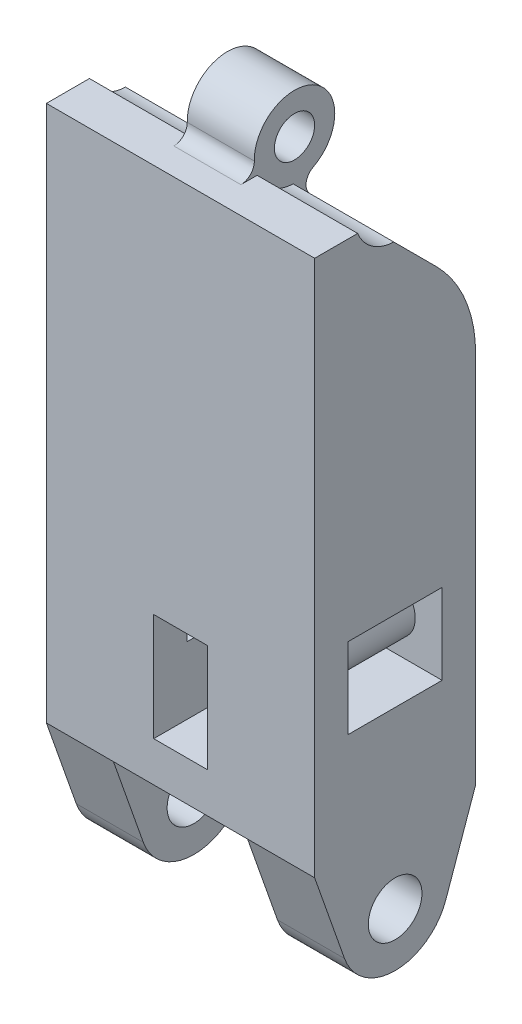
from build123d import *

# Parameters (mm, degrees)
SKETCH1_W               = 20
SKETCH1_H               = 40
BOSS_EXTRUDE1_DEPTH     = 12
CUT_EXTRUDE1_DEPTH      = 43.941821107
CUT_EXTRUDE1_DEPTH_BACK = 43.941821107
CUT_EXTRUDE2_DEPTH      = 43.941821107
CUT_EXTRUDE2_DEPTH_BACK = 43.941821107
SKETCH4_R               = 3
SKETCH4_R_2             = 1.5
BOSS_EXTRUDE2_DEPTH     = 2.5
FILLET1_R               = 1
SKETCH5_R               = 2
BOSS_EXTRUDE3_DEPTH     = 5
BOSS_EXTRUDE4_START     = -5
SKETCH7_R               = 2
BOSS_EXTRUDE4_DEPTH     = 5
FILLET2_R               = 10
SKETCH8_W               = 7
SKETCH8_H               = 6
CUT_EXTRUDE3_DEPTH      = 8
SKETCH10_R              = 2
BOSS_EXTRUDE5_DEPTH     = 7
SKETCH11_W              = 7
SKETCH11_H              = 6
CUT_EXTRUDE4_DEPTH      = 8
SKETCH12_R              = 2
BOSS_EXTRUDE6_DEPTH     = 8
SKETCH13_W              = 4
SKETCH13_H              = 8
CUT_EXTRUDE5_DEPTH      = 6
SKETCH16_W              = 4
SKETCH16_H              = 3
CUT_EXTRUDE6_DEPTH      = 6
SKETCH17_W              = 4
SKETCH17_H              = 8.017766953
CUT_EXTRUDE7_DEPTH      = 52.429563482


with BuildPart() as part:
    # Sketch1 → Boss-Extrude1 (new body)
    with BuildSketch(Plane.XY):
        with Locations((0, -20)):
            Rectangle(SKETCH1_W, SKETCH1_H)
    extrude(amount=BOSS_EXTRUDE1_DEPTH)

    # Sketch2 → Cut-Extrude1 (cut, two sides: drawn at the far end of the back side and taken through both)
    with BuildSketch(Plane(origin=(0, 0, 0), x_dir=(0, 0, -1), z_dir=(1, 0, 0)).offset(-CUT_EXTRUDE1_DEPTH_BACK)):
        Polygon((-8, 0), (0, 0), (0, -8), align=None)
    extrude(amount=CUT_EXTRUDE1_DEPTH + CUT_EXTRUDE1_DEPTH_BACK, mode=Mode.SUBTRACT)

    # Sketch3 → Cut-Extrude2 (cut, two sides: drawn at the far end of the back side and taken through both)
    with BuildSketch(Plane(origin=(0, 0, 0), x_dir=(0, 0, -1), z_dir=(1, 0, 0)).offset(-CUT_EXTRUDE2_DEPTH_BACK)):
        with BuildLine():
            ThreePointArc((-3, 1.1), (-6.559834153, 4.04730143), (-8.791057147, 0))
            Line((-8.791057147, 0), (-7.019803903, 0))
            ThreePointArc((-7.019803903, 0), (-6.600122548, 2.474719218), (-4.5, 1.1))
            ThreePointArc((-4.5, 1.1), (-4.625280782, 0.499877452), (-4.980196097, 0))
            Line((-4.980196097, 0), (-3.208942853, 0))
            ThreePointArc((-3.208942853, 0), (-3.05269857, 0.540165847), (-3, 1.1))
        make_face()
        with BuildLine():
            Line((-7.019803903, 0), (-8.791057147, 0))
            ThreePointArc((-8.791057147, 0), (-6, -1.9), (-3.208942853, 0))
            Line((-3.208942853, 0), (-4.980196097, 0))
            ThreePointArc((-4.980196097, 0), (-6, -0.4), (-7.019803903, 0))
        make_face()
    extrude(amount=CUT_EXTRUDE2_DEPTH + CUT_EXTRUDE2_DEPTH_BACK, mode=Mode.SUBTRACT)

    # Sketch4 → Boss-Extrude2 (add, symmetric)
    with BuildSketch(Plane(origin=(0, 0, 0), x_dir=(0, 0, -1), z_dir=(1, 0, 0))):
        with Locations((-6, 1.1)):
            Circle(SKETCH4_R)
        with Locations((-6, 1.1)):
            Circle(SKETCH4_R_2, mode=Mode.SUBTRACT)
    extrude(amount=BOSS_EXTRUDE2_DEPTH, both=True)

    # Fillet1
    fillet1_edges = [part.edges().sort_by_distance(p)[0] for p in [
        (0, -1.898274836, 6.101725164),
        (0, 0, 8.791057147),
    ]]
    fillet(fillet1_edges, radius=FILLET1_R)

    # Sketch5 → Boss-Extrude3 (add)
    with BuildSketch(Plane(origin=(10, 0, 0), x_dir=(0, 0, -1), z_dir=(1, 0, 0))):
        with BuildLine():
            Line((-2.226818383, -46.327817941), (0, -40))
            Line((0, -40), (-12, -40))
            Line((-12, -40), (-9.773181617, -46.327817941))
            ThreePointArc((-9.773181617, -46.327817941), (-6, -49), (-2.226818383, -46.327817941))
        make_face()
        with Locations(Location((-6, -45, 0), (0, 0, 90))):
            Circle(SKETCH5_R, mode=Mode.SUBTRACT)
    extrude(amount=-BOSS_EXTRUDE3_DEPTH)

    # Sketch7 → Boss-Extrude4 (add)
    with BuildSketch(Plane.ZY.offset(10).offset(BOSS_EXTRUDE4_START)):
        with BuildLine():
            Line((12, -40), (0, -40))
            Line((0, -40), (2.226818383, -46.327817941))
            ThreePointArc((2.226818383, -46.327817941), (6, -49), (9.773181617, -46.327817941))
            Line((9.773181617, -46.327817941), (12, -40))
        make_face()
        with Locations(Location((6, -45, 0), (0, 0, 90))):
            Circle(SKETCH7_R, mode=Mode.SUBTRACT)
    extrude(amount=BOSS_EXTRUDE4_DEPTH)

    # Fillet2
    fillet2_edges = [part.edges().sort_by_distance(p)[0] for p in [
        (0, -8, 0),
    ]]
    fillet(fillet2_edges, radius=FILLET2_R)

    # Sketch8 → Cut-Extrude3 (cut)
    with BuildSketch(Plane.ZY.offset(10)):
        with Locations((6, -29)):
            Rectangle(SKETCH8_W, SKETCH8_H)
    extrude(amount=-CUT_EXTRUDE3_DEPTH, mode=Mode.SUBTRACT)

    # Sketch10 → Boss-Extrude5 (add)
    with BuildSketch(Plane(origin=(0, 0, 9.5), x_dir=(-1, 0, 0), z_dir=(0, 0, -1))):
        with Locations(Location((6, -29, 0), (0, 0, 180))):
            Circle(SKETCH10_R)
    extrude(amount=BOSS_EXTRUDE5_DEPTH)

    # Sketch11 → Cut-Extrude4 (cut)
    with BuildSketch(Plane(origin=(10, 0, 0), x_dir=(0, 0, -1), z_dir=(1, 0, 0))):
        with Locations((-6, -29)):
            Rectangle(SKETCH11_W, SKETCH11_H)
    extrude(amount=-CUT_EXTRUDE4_DEPTH, mode=Mode.SUBTRACT)

    # Sketch12 → Boss-Extrude6 (add)
    with BuildSketch(Plane(origin=(0, 0, 9.5), x_dir=(-1, 0, 0), z_dir=(0, 0, -1))):
        with Locations(Location((-6, -29, 0), (0, 0, 180))):
            Circle(SKETCH12_R)
    extrude(amount=BOSS_EXTRUDE6_DEPTH)

    # Sketch13 → Cut-Extrude5 (cut)
    with BuildSketch(Plane(origin=(0, 0, 0), x_dir=(-1, 0, 0), z_dir=(0, 0, -1))):
        with Locations((0, -33.017766953)):
            Rectangle(SKETCH13_W, SKETCH13_H)
        with Locations((0, -19.088834765)):
            Rectangle(SKETCH13_W, SKETCH13_H)
    extrude(amount=-CUT_EXTRUDE5_DEPTH, mode=Mode.SUBTRACT)

    # Sketch16 → Cut-Extrude6 (cut)
    with BuildSketch(Plane.XZ.offset(29.017766953)):
        with Locations((0, 4.5)):
            Rectangle(SKETCH16_W, SKETCH16_H)
    extrude(amount=-CUT_EXTRUDE6_DEPTH, mode=Mode.SUBTRACT)

    # Sketch17 → Cut-Extrude7 (cut, through all)
    with BuildSketch(Plane(origin=(0, 0, 0), x_dir=(-1, 0, 0), z_dir=(0, 0, -1))):
        with Locations((0, -33.008883477)):
            Rectangle(SKETCH17_W, SKETCH17_H)
    extrude(amount=-CUT_EXTRUDE7_DEPTH, mode=Mode.SUBTRACT)


solid = part.part
